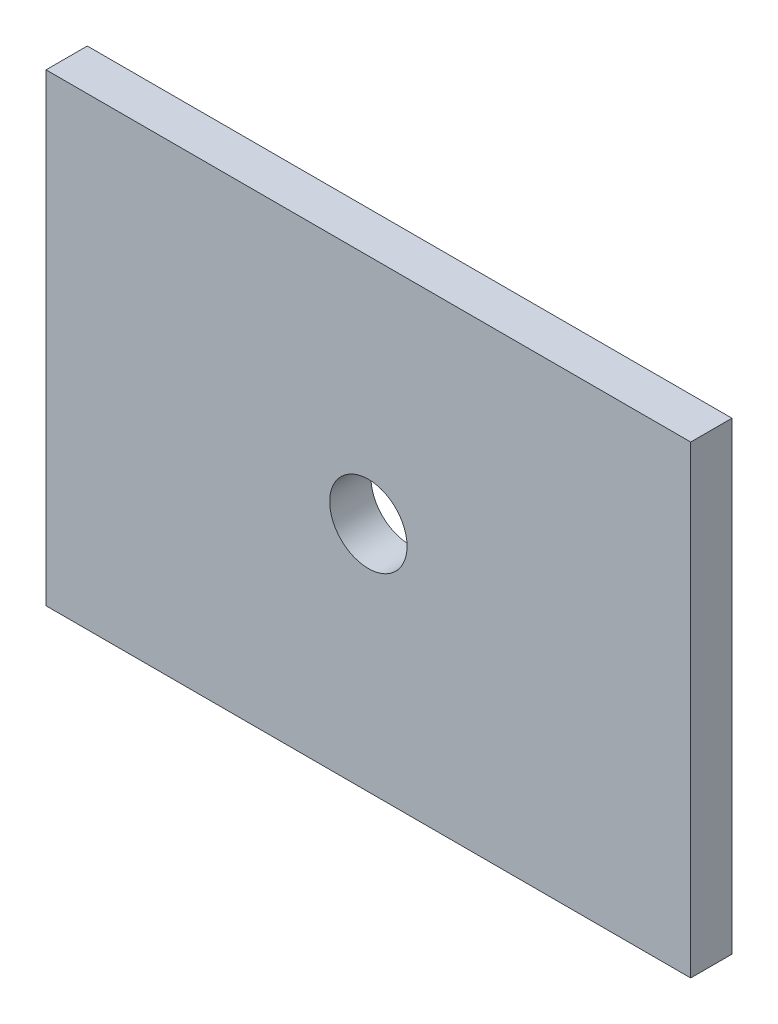
from build123d import *

# Parameters (mm, degrees)
SKETCH_1_W                = 250
SKETCH_1_H                = 180
EXTRUDE_1_DEPTH           = 16
HOLE_WIZARD_6_0_6_1_D     = 30
HOLE_WIZARD_6_0_6_1_DEPTH = 20
HOLE_WIZARD_6_0_6_1_TIP   = 9.012909285


with BuildPart() as part:
    # 草图1 → 凸台-拉伸1 (new body)
    with BuildSketch(Plane.XY):
        Rectangle(SKETCH_1_W, SKETCH_1_H)
    extrude(amount=EXTRUDE_1_DEPTH)

    # Ø6.0 (6) 直径孔1
    with Locations(Plane.XY.offset(16)):
        with Locations((0, 0)):
            Hole(HOLE_WIZARD_6_0_6_1_D / 2, depth=HOLE_WIZARD_6_0_6_1_DEPTH)
            with Locations((0, 0, -(HOLE_WIZARD_6_0_6_1_DEPTH + HOLE_WIZARD_6_0_6_1_TIP / 2))):  # 118° drill point
                Cone(0, HOLE_WIZARD_6_0_6_1_D / 2, HOLE_WIZARD_6_0_6_1_TIP, mode=Mode.SUBTRACT)


solid = part.part
